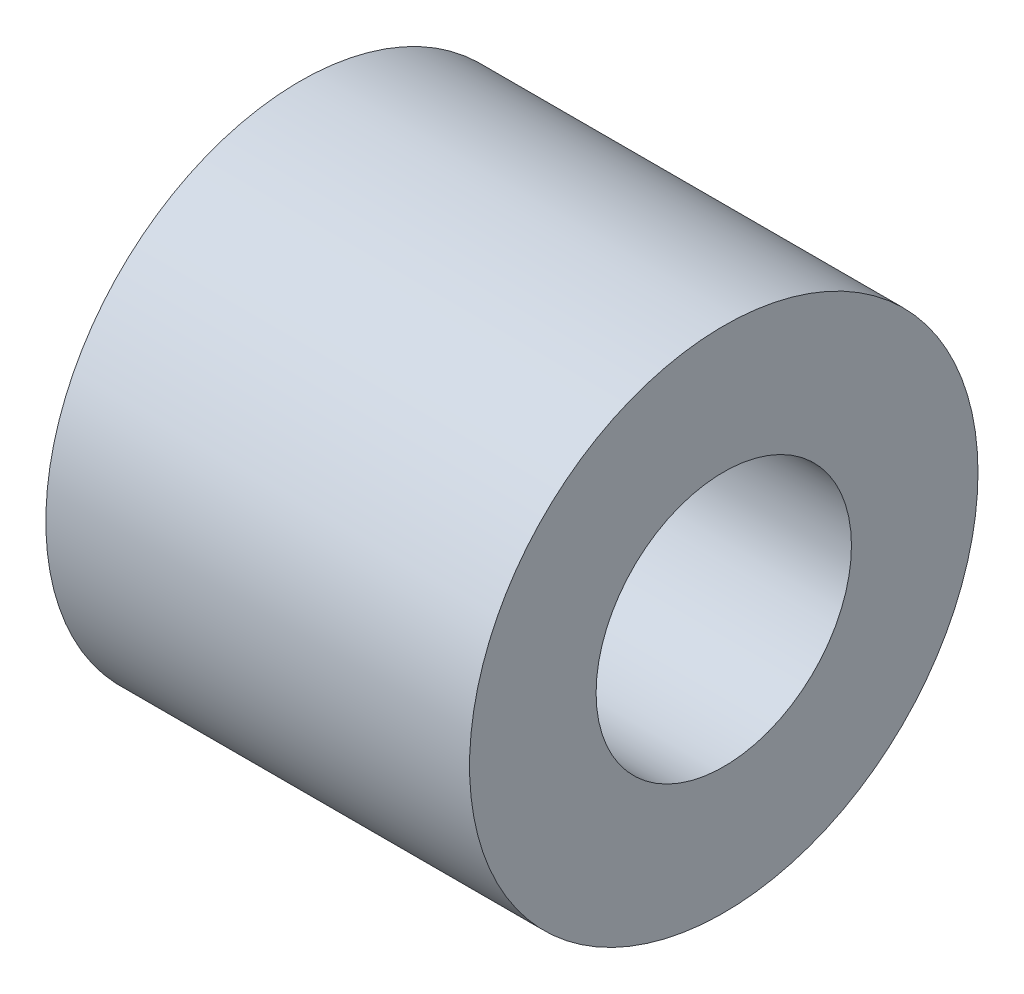
from build123d import *

# Parameters (mm, degrees)
CROQUIS2_R              = 6
SALIENTE_EXTRUIR1_DEPTH = 10
CROQUIS3_R              = 3.013240458
CORTAR_EXTRUIR1_DEPTH   = 10


with BuildPart() as part:
    # Croquis2 → Saliente-Extruir1 (new body)
    with BuildSketch(Plane(origin=(0, 0, 0), x_dir=(0, 0, -1), z_dir=(1, 0, 0))):
        Circle(CROQUIS2_R)
    extrude(amount=SALIENTE_EXTRUIR1_DEPTH)

    # Croquis3 → Cortar-Extruir1 (cut)
    with BuildSketch(Plane.ZY):
        Circle(CROQUIS3_R)
    extrude(amount=-CORTAR_EXTRUIR1_DEPTH, mode=Mode.SUBTRACT)


solid = part.part
